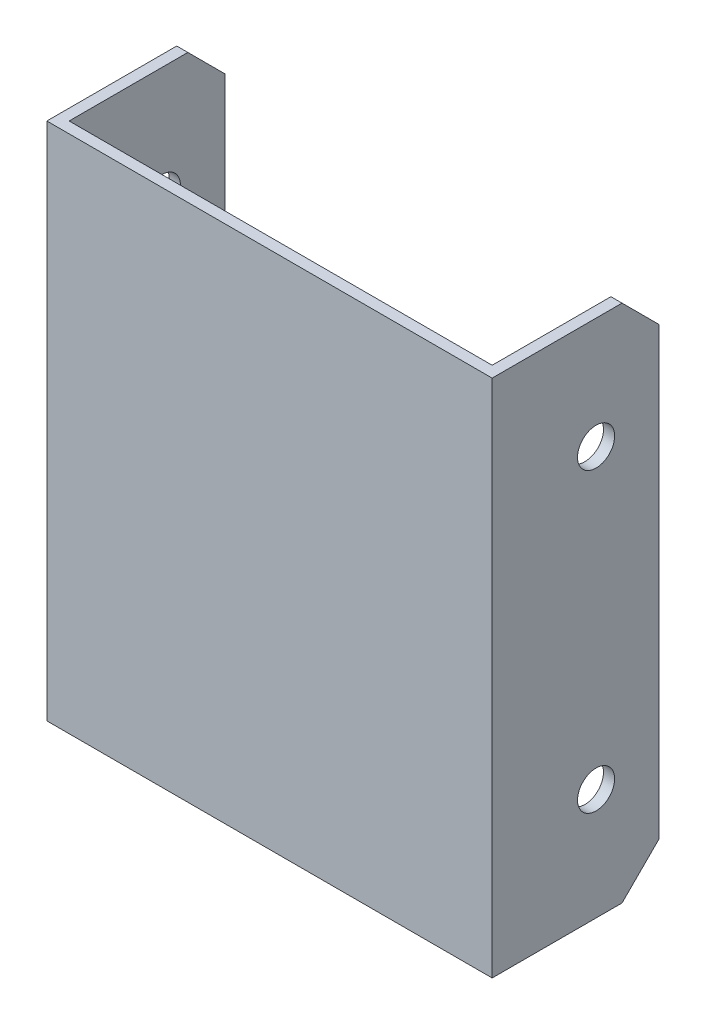
from build123d import *

# Parameters (mm, degrees)
BOSS_EXTRUDE1_DEPTH = 70
SKETCH3_R           = 2.5
CUT_EXTRUDE1_DEPTH  = 60
CHAMFER1_SIZE       = 5


with BuildPart() as part:
    # Sketch1 → Boss-Extrude1 (new body)
    with BuildSketch(Plane(origin=(0, 0, 0), x_dir=(1, 0, 0), z_dir=(0, 1, 0))):
        Polygon((0, 0), (60, 0), (60, 22.5), (58.5, 22.5), (58.5, 1.5), (1.5, 1.5), (1.5, 22.5), (0, 22.5), align=None)
    extrude(amount=BOSS_EXTRUDE1_DEPTH)

    # Sketch3 → Cut-Extrude1 (cut)
    with BuildSketch(Plane(origin=(60, 0, 0), x_dir=(0, 0, -1), z_dir=(1, 0, 0))):
        with Locations((14, 55)):
            Circle(SKETCH3_R)
        with Locations(Location((14, 15, 0), (0, 0, 180))):
            Circle(SKETCH3_R)
    extrude(amount=-CUT_EXTRUDE1_DEPTH, mode=Mode.SUBTRACT)

    # Chamfer1
    chamfer1_edges = [part.edges().sort_by_distance(p)[0] for p in [
        (0.75, 0, -22.5),
        (59.25, 70, -22.5),
        (0.75, 70, -22.5),
        (59.25, 0, -22.5),
    ]]
    chamfer(chamfer1_edges, length=CHAMFER1_SIZE)


solid = part.part
